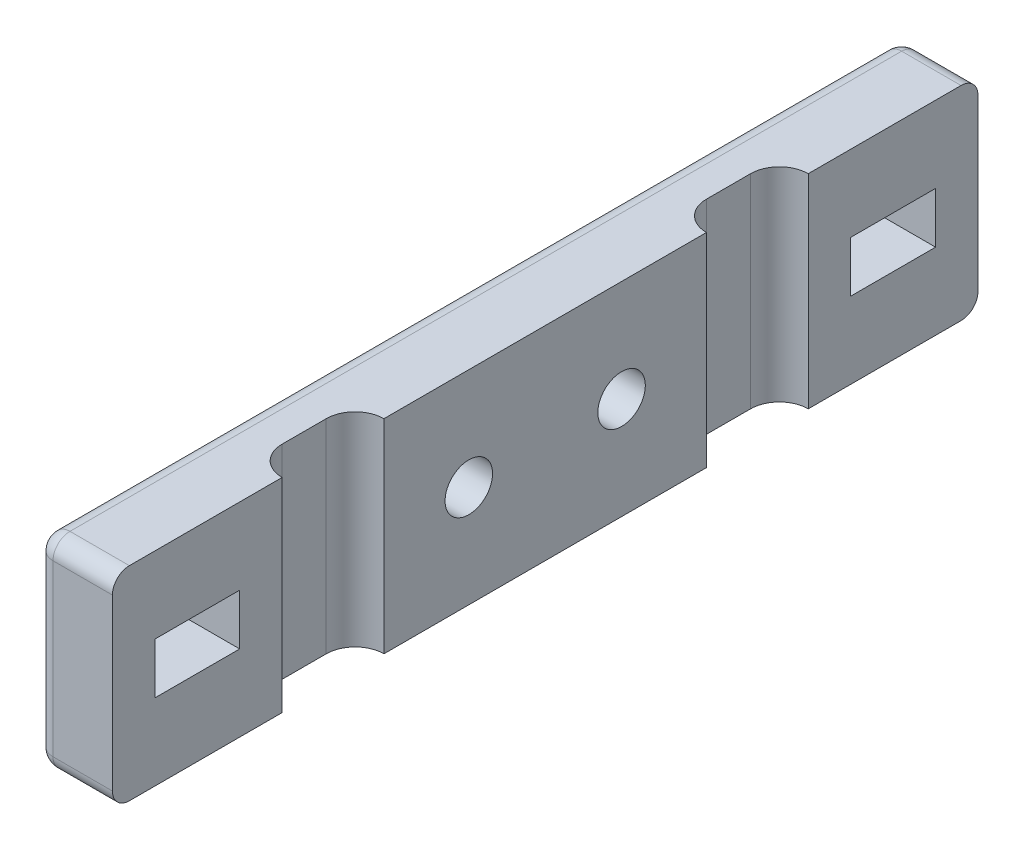
from build123d import *

# Parameters (mm, degrees)
BASE_DEPTH                 = 12
SCREWS_ZIP_TIE_HOLES_REACH = 30.539
SKETCH2_R                  = 1.4
SKETCH2_W                  = 5
SKETCH2_H                  = 3
F_1MM_EDGE_FILLETS_R       = 1


with BuildPart() as part:
    # Sketch1 → Base (new body)
    with BuildSketch(Plane(origin=(0, 0, 0), x_dir=(1, 0, 0), z_dir=(0, 1, 0))):
        with BuildLine():
            Line((4.5, 25.5), (4.5, 15.5))
            ThreePointArc((4.5, 15.5), (3.297918472, 15.002081528), (2.8, 13.8))
            Line((2.8, 13.8), (2.8, 11.2))
            ThreePointArc((2.8, 11.2), (3.297918472, 9.997918472), (4.5, 9.5))
            Line((4.5, 9.5), (4.5, -9.5))
            ThreePointArc((4.5, -9.5), (3.297918472, -9.997918472), (2.8, -11.2))
            Line((2.8, -11.2), (2.8, -13.8))
            ThreePointArc((2.8, -13.8), (3.297918472, -15.002081528), (4.5, -15.5))
            Line((4.5, -15.5), (4.5, -25.5))
            Line((4.5, -25.5), (0, -25.5))
            Line((0, -25.5), (0, 25.5))
            Line((0, 25.5), (4.5, 25.5))
        make_face()
    extrude(amount=BASE_DEPTH)

    # Sketch2 → Screws & Zip Tie Holes (cut, up to next)
    with BuildSketch(Plane(origin=(4.5, 0, 0), x_dir=(0, 0, -1), z_dir=(1, 0, 0)), mode=Mode.PRIVATE) as screws_zip_tie_holes_sk1:
        with Locations((-4.5, 6)):
            Circle(SKETCH2_R)
    screws_zip_tie_holes_tool1 = extrude(screws_zip_tie_holes_sk1.sketch, amount=-SCREWS_ZIP_TIE_HOLES_REACH, mode=Mode.PRIVATE) & part.part
    # Sketch2 → Screws & Zip Tie Holes (cut, up to next)
    with BuildSketch(Plane(origin=(4.5, 0, 0), x_dir=(0, 0, -1), z_dir=(1, 0, 0)), mode=Mode.PRIVATE) as screws_zip_tie_holes_sk2:
        with Locations((4.5, 6)):
            Circle(SKETCH2_R)
    screws_zip_tie_holes_tool2 = extrude(screws_zip_tie_holes_sk2.sketch, amount=-SCREWS_ZIP_TIE_HOLES_REACH, mode=Mode.PRIVATE) & part.part
    # Sketch2 → Screws & Zip Tie Holes (cut, up to next)
    with BuildSketch(Plane(origin=(4.5, 0, 0), x_dir=(0, 0, -1), z_dir=(1, 0, 0)), mode=Mode.PRIVATE) as screws_zip_tie_holes_sk3:
        with Locations((20.5, 6)):
            Rectangle(SKETCH2_W, SKETCH2_H)
    screws_zip_tie_holes_tool3 = extrude(screws_zip_tie_holes_sk3.sketch, amount=-SCREWS_ZIP_TIE_HOLES_REACH, mode=Mode.PRIVATE) & part.part
    # Sketch2 → Screws & Zip Tie Holes (cut, up to next)
    with BuildSketch(Plane(origin=(4.5, 0, 0), x_dir=(0, 0, -1), z_dir=(1, 0, 0)), mode=Mode.PRIVATE) as screws_zip_tie_holes_sk4:
        with Locations((-20.5, 6)):
            Rectangle(SKETCH2_W, SKETCH2_H)
    screws_zip_tie_holes_tool4 = extrude(screws_zip_tie_holes_sk4.sketch, amount=-SCREWS_ZIP_TIE_HOLES_REACH, mode=Mode.PRIVATE) & part.part
    add(screws_zip_tie_holes_tool1.solids().sort_by_distance((4.5, 6, 4.5))[0], mode=Mode.SUBTRACT)
    add(screws_zip_tie_holes_tool2.solids().sort_by_distance((4.5, 6, -4.5))[0], mode=Mode.SUBTRACT)
    add(screws_zip_tie_holes_tool3.solids().sort_by_distance((4.5, 6, -20.5))[0], mode=Mode.SUBTRACT)
    add(screws_zip_tie_holes_tool4.solids().sort_by_distance((4.5, 6, 20.5))[0], mode=Mode.SUBTRACT)

    # 1mm Edge Fillets
    f_1mm_edge_fillets_edges = [part.edges().sort_by_distance(p)[0] for p in [
        (2.25, 12, -25.5),
        (2.25, 0, -25.5),
        (2.25, 0, 25.5),
        (2.25, 12, 25.5),
        (0, 0, 0),
        (0, 6, 25.5),
        (0, 6, -25.5),
        (0, 12, 0),
    ]]
    fillet(f_1mm_edge_fillets_edges, radius=F_1MM_EDGE_FILLETS_R)


solid = part.part
